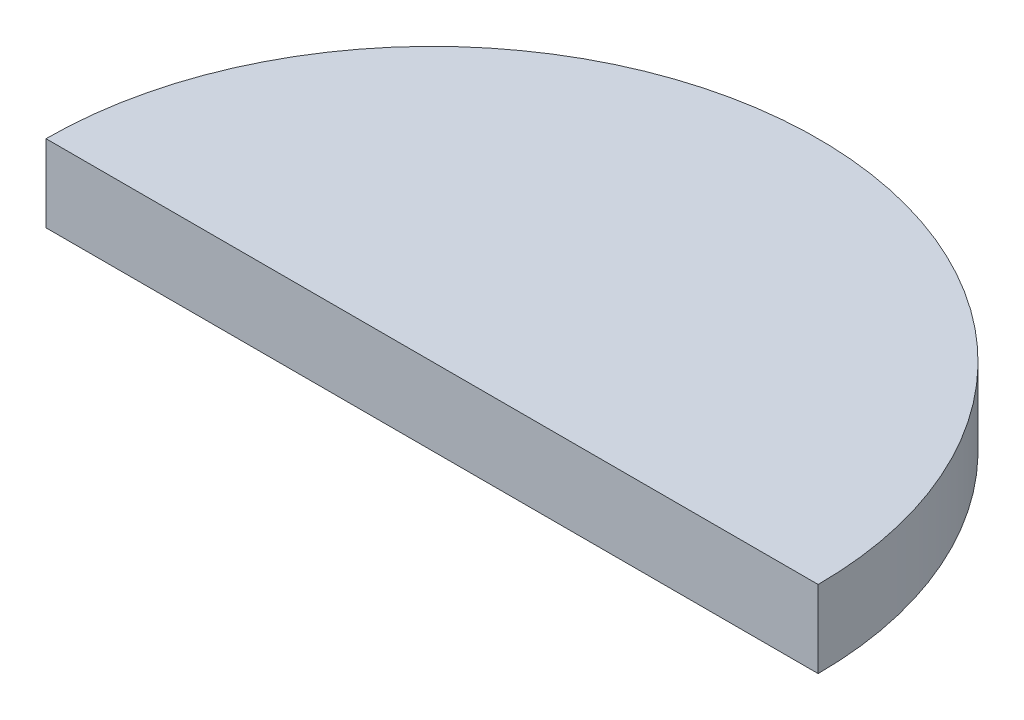
from build123d import *

# Parameters (mm, degrees)
EXTRUDE_1_DEPTH = 2


with BuildPart() as part:
    # 草图1 → 凸台-拉伸1 (new body)
    with BuildSketch(Plane(origin=(0, 0, 0), x_dir=(1, 0, 0), z_dir=(0, 1, 0))):
        with BuildLine():
            Line((0, 0), (20, 0))
            ThreePointArc((20, 0), (10, 10), (0, 0))
        make_face()
    extrude(amount=EXTRUDE_1_DEPTH)


solid = part.part
